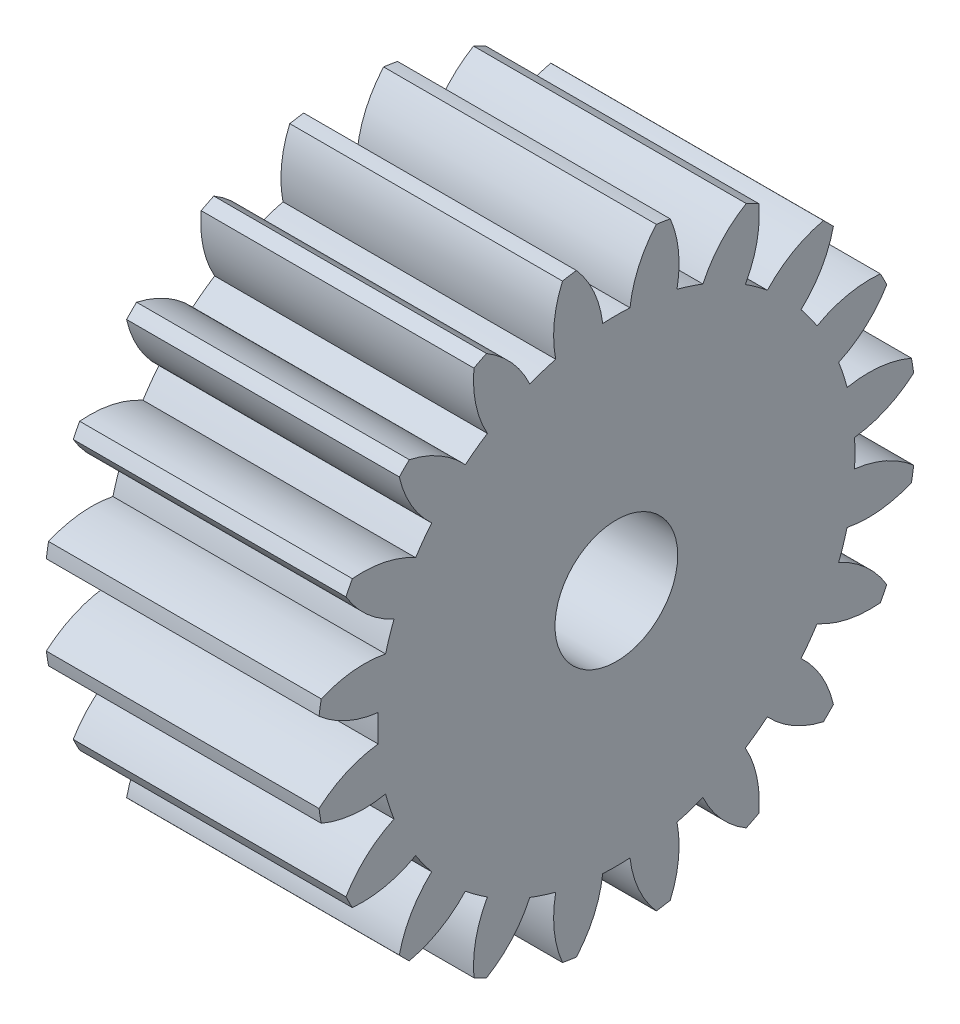
from build123d import *

# Parameters (mm, degrees)
BASPROSKE_W        = 10
BASPROSKE_H        = 11
TOOTHCUT_DEPTH     = 19.493242009
TEETHCUTS_COUNT    = 20
TEETHCUTS_ANGLE    = 342
BORSKE_R           = 2
BORE_DEPTH         = 50.0000508
SKETCH1_R          = 2.25
CUT_EXTRUDE1_DEPTH = 19.376827944


with BuildPart() as part:
    # BasProSke → Base-Revolve (revolve)
    with BuildSketch(Plane(origin=(0, 0, 0), x_dir=(1, 0, 0), z_dir=(0, 1, 0)), mode=Mode.PRIVATE) as base_revolve_sk:
        with Locations((5, 5.5)):
            Rectangle(BASPROSKE_W, BASPROSKE_H)
    revolve(base_revolve_sk.sketch.rotate(Axis((-10, 0, 0), (1, 0, 0)), 180), axis=Axis((-10, 0, 0), (1, 0, 0)))

    # TooCutSke → ToothCut (cut, through all)
    with BuildSketch(Plane(origin=(0, 0, 0), x_dir=(0, 0, -1), z_dir=(1, 0, 0))):
        with BuildLine():
            ThreePointArc((0.499924007, 8.734705318), (0, 8.749), (-0.499924007, 8.734705318))
            ThreePointArc((-0.499924007, 8.734705318), (-0.824302243, 9.905497836), (-1.485192705, 10.924909509))
            ThreePointArc((-1.485192705, 10.924909509), (0, 11.0254), (1.485192705, 10.924909509))
            ThreePointArc((1.485192705, 10.924909509), (0.824302243, 9.905497836), (0.499924007, 8.734705318))
        make_face()
    toothcut = extrude(amount=TOOTHCUT_DEPTH, mode=Mode.SUBTRACT)

    # TeethCuts: ToothCut ×20 about axis
    teethcuts_axis = Axis((-10, 0, 0), (1, 0, 0))
    for i in range(1, TEETHCUTS_COUNT):
        add(toothcut.rotate(teethcuts_axis, i * TEETHCUTS_ANGLE / (TEETHCUTS_COUNT - 1)), mode=Mode.SUBTRACT)

    # BorSke → Bore (cut, symmetric)
    with BuildSketch(Plane(origin=(0, 0, 0), x_dir=(0, 0, -1), z_dir=(1, 0, 0))):
        with Locations(Location((0, 0, 0), (0, 0, 180))):
            Circle(BORSKE_R)
    extrude(amount=BORE_DEPTH, both=True, mode=Mode.SUBTRACT)

    # Sketch1 → Cut-Extrude1 (cut, through all)
    with BuildSketch(Plane(origin=(10, 0, 0), x_dir=(0, 0, -1), z_dir=(1, 0, 0))):
        Circle(SKETCH1_R)
    extrude(amount=-CUT_EXTRUDE1_DEPTH, mode=Mode.SUBTRACT)


solid = part.part
